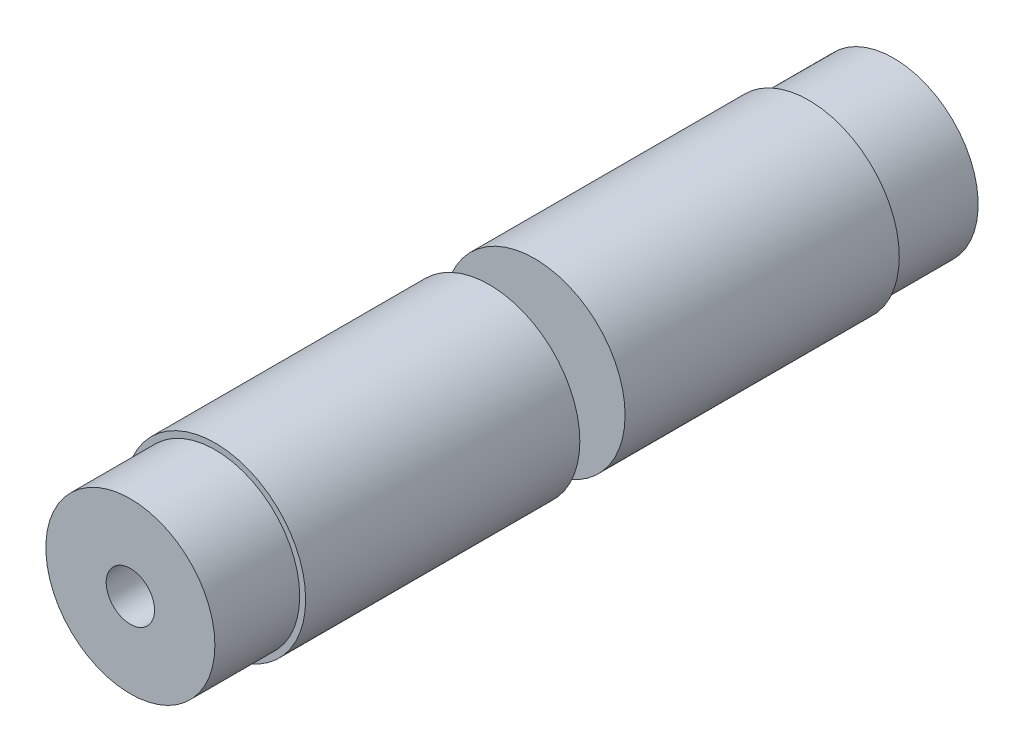
from build123d import *

# Parameters (mm, degrees)
SKETCH1_R           = 16
SKETCH1_R_2         = 4.275
BOSS_EXTRUDE1_DEPTH = 105
SKETCH2_R           = 14.95
SKETCH2_R_2         = 4.275
BOSS_EXTRUDE2_DEPTH = 15
BOSS_EXTRUDE3_START = 15
SKETCH3_R           = 14.95
SKETCH3_R_2         = 4.275
BOSS_EXTRUDE3_DEPTH = 15
CUT_EXTRUDE1_START  = 48.5
SKETCH4_R           = 16
CUT_EXTRUDE1_DEPTH  = 8


with BuildPart() as part:
    # Sketch1 → Boss-Extrude1 (new body)
    with BuildSketch(Plane.XY):
        Circle(SKETCH1_R)
        Circle(SKETCH1_R_2, mode=Mode.SUBTRACT)
    extrude(amount=BOSS_EXTRUDE1_DEPTH)

    # Sketch2 → Boss-Extrude2 (add)
    with BuildSketch(Plane.XY.offset(105)):
        Circle(SKETCH2_R)
        Circle(SKETCH2_R_2, mode=Mode.SUBTRACT)
    extrude(amount=BOSS_EXTRUDE2_DEPTH)

    # Sketch3 → Boss-Extrude3 (add)
    with BuildSketch(Plane(origin=(0, 0, 0), x_dir=(-1, 0, 0), z_dir=(0, 0, -1)).offset(BOSS_EXTRUDE3_START)):
        with Locations(Location((0, 0, 0), (0, 0, 180))):
            Circle(SKETCH3_R)
        Circle(SKETCH3_R_2, mode=Mode.SUBTRACT)
    extrude(amount=-BOSS_EXTRUDE3_DEPTH)

    # Sketch4 → Cut-Extrude1 (cut)
    with BuildSketch(Plane.XY.offset(CUT_EXTRUDE1_START)):
        Circle(SKETCH4_R)
    extrude(amount=CUT_EXTRUDE1_DEPTH, mode=Mode.SUBTRACT)


with BuildPart() as cut_extrude1_piece_1:
    # of the separate pieces the step leaves, piece 1, a body of its own (cut_extrude1_pieces)
    add(part.part.solids().sort_by_distance((16, 0, 0))[0])


with BuildPart() as cut_extrude1_piece_2:
    # of the separate pieces the step leaves, piece 2, a body of its own (cut_extrude1_pieces)
    add(part.part.solids().sort_by_distance((16, 0, 56.5))[0])


solid = Compound([cut_extrude1_piece_1.part, cut_extrude1_piece_2.part])
